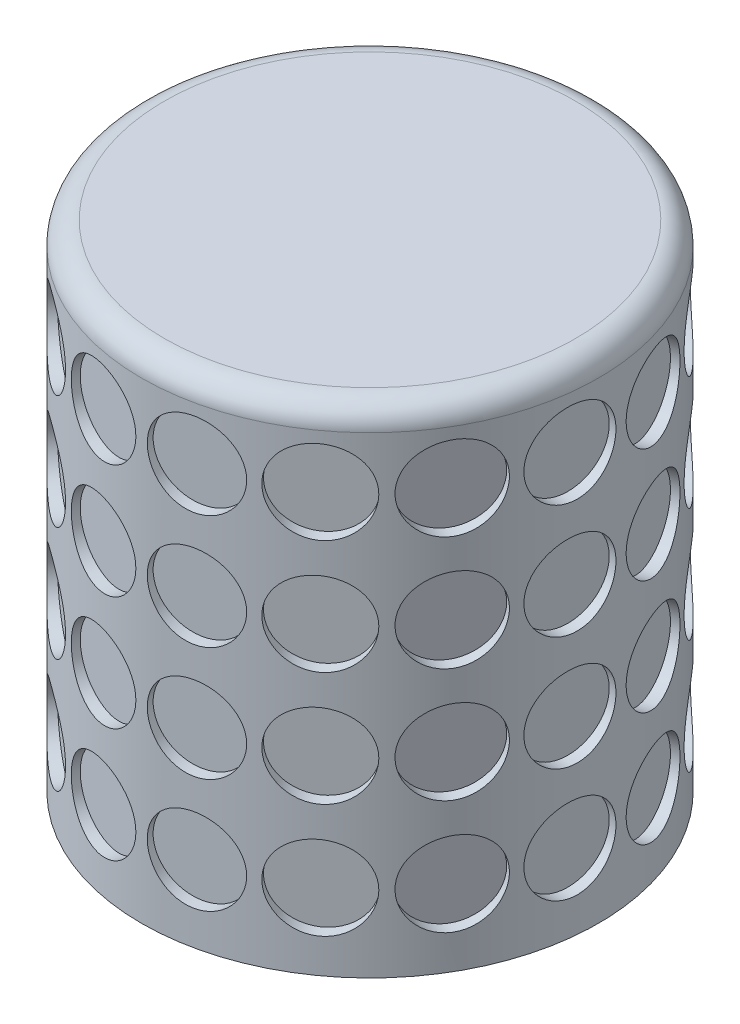
from build123d import *

# Parameters (mm, degrees)
ESQUISSE1_W                  = 55
ESQUISSE1_H                  = 7.5
CONG_1_R                     = 3
ESQUISSE4_R                  = 5.5
ENL_V_MAT_EXTRU_1_DEPTH      = 1.5
R_P_TITION_CIRCULAIRE1_COUNT = 15
ESQUISSE5_R                  = 6.5
ESQUISSE5_R_2                = 4.75
BOSS_EXTRU_1_DEPTH           = 20
CONG_2_R                     = 10


with BuildPart() as part:
    # Esquisse1 → Révolution1 (revolve)
    with BuildSketch(Plane(origin=(0, 0, 0), x_dir=(0, 1, 0), z_dir=(0, 0, 1)), mode=Mode.PRIVATE) as r_volution1_sk:
        with Locations((18.884615385, -1.75)):
            Rectangle(ESQUISSE1_W, ESQUISSE1_H)
        Polygon((56.384615385, -5.5), (56.384615385, 24.5), (46.384615385, 24.5), (46.384615385, 2), (46.384615385, -5.5), align=None)
    revolve(r_volution1_sk.sketch.rotate(Axis((-24.5, 56.384615385, 0), (0, -1, 0)), 90), axis=Axis((-24.5, 56.384615385, 0), (0, -1, 0)))

    # Congé1
    cong_1_edges = [part.edges().sort_by_distance(p)[0] for p in [
        (-24.5, 56.384615385, -30),
    ]]
    fillet(cong_1_edges, radius=CONG_1_R)

    # Esquisse4 → Enlèv. mat.-Extru.1 (cut)
    with BuildSketch(Plane(origin=(-24.5, 56.384615385, -30), x_dir=(-1, 0, 0), z_dir=(0, 0, -1))):
        with Locations((0, -10)):
            Circle(ESQUISSE4_R)
        with Locations((0, -25)):
            Circle(ESQUISSE4_R)
        with Locations((0, -40)):
            Circle(ESQUISSE4_R)
        with Locations((0, -55)):
            Circle(ESQUISSE4_R)
    enl_v_mat_extru_1 = extrude(amount=-ENL_V_MAT_EXTRU_1_DEPTH, mode=Mode.SUBTRACT)

    # Répétition circulaire1: Enlèv. mat.-Extru.1 ×15 about axis
    r_p_tition_circulaire1_axis = Axis((-24.5, 0, 0), (0, 1, 0))
    for i in range(1, R_P_TITION_CIRCULAIRE1_COUNT):
        add(enl_v_mat_extru_1.rotate(r_p_tition_circulaire1_axis, i * 360 / R_P_TITION_CIRCULAIRE1_COUNT), mode=Mode.SUBTRACT)

    # Esquisse5 → Boss.-Extru.1 (add)
    with BuildSketch(Plane.XZ.offset(-46.384615385)):
        with Locations(Location((-24.5, 0, 0), (0, 0, 90))):
            Circle(ESQUISSE5_R)
        with Locations(Location((-24.5, 0, 0), (0, 0, 270))):
            Circle(ESQUISSE5_R_2, mode=Mode.SUBTRACT)
    extrude(amount=BOSS_EXTRU_1_DEPTH)

    # Congé2
    cong_2_edges = [part.edges().sort_by_distance(p)[0] for p in [
        (-24.5, 46.384615385, -6.5),
    ]]
    fillet(cong_2_edges, radius=CONG_2_R)


solid = part.part
